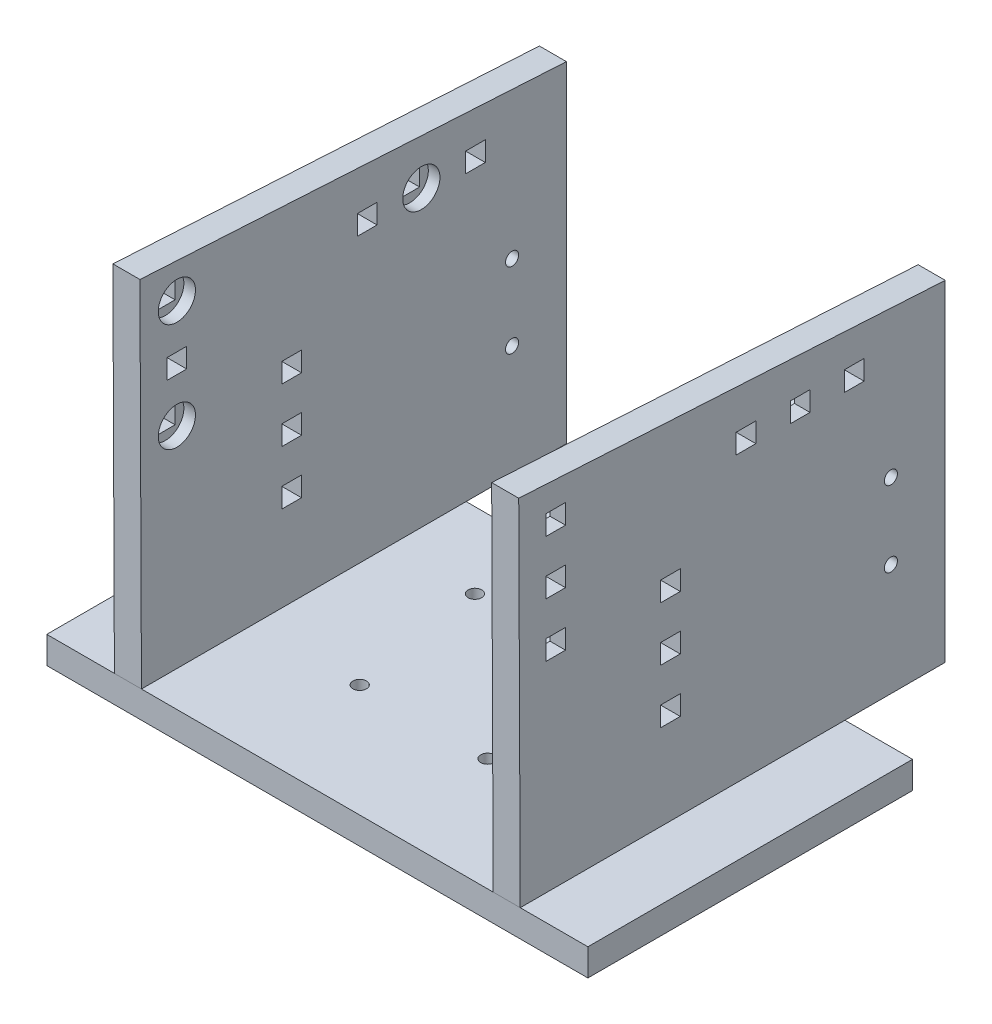
from build123d import *

# Parameters (mm, degrees)
SKETCH1_W                                     = 127
SKETCH1_H                                     = 76.2
BOSS_EXTRUDE1_DEPTH                           = 6.35
SKETCH3_R                                     = 1.5367
SKETCH3_W                                     = 4.6228
SKETCH3_H                                     = 4.6228
BOSS_EXTRUDE2_DEPTH                           = 6.35
CBORE_FOR_8_BUTTON_HEAD_CAP_SCREW1_AT_2_COUNT = 2
CBORE_FOR_8_BUTTON_HEAD_CAP_SCREW1_AT_2_PITCH = 57.667566167
CBORE_FOR_8_BUTTON_HEAD_CAP_SCREW1_AT_3_COUNT = 2
CBORE_FOR_8_BUTTON_HEAD_CAP_SCREW1_AT_3_PITCH = 60.644913617
SKETCH4_R                                     = 1.6
CUT_EXTRUDE1_DEPTH                            = 185.758568144


with BuildPart() as part:
    # Sketch1 → Boss-Extrude1 (new body)
    with BuildSketch(Plane(origin=(0, 0, 0), x_dir=(1, 0, 0), z_dir=(0, 1, 0))):
        with Locations((63.5, 38.1)):
            Rectangle(SKETCH1_W, SKETCH1_H)
    extrude(amount=BOSS_EXTRUDE1_DEPTH)

    # Sketch3 → Boss-Extrude2 (add)
    with BuildSketch(Plane(origin=(104.775, 0, 0), x_dir=(0, 0, -1), z_dir=(1, 0, 0))):
        Polygon((0, 6.35), (-0.3556, 89.7636), (99.7458, 83.9978), (99.7458, 6.35), align=None)
        with Locations((86.986368363, 50.326031637)):
            Circle(SKETCH3_R, mode=Mode.SUBTRACT)
        with Locations((86.986368363, 32.596831637)):
            Circle(SKETCH3_R, mode=Mode.SUBTRACT)
        with Locations((8.3058, 55.7022)):
            Rectangle(SKETCH3_W, SKETCH3_H, mode=Mode.SUBTRACT)
        with Locations((8.3058, 68.4022)):
            Rectangle(SKETCH3_W, SKETCH3_H, mode=Mode.SUBTRACT)
        with Locations((35.246568363, 41.461431637)):
            Rectangle(SKETCH3_W, SKETCH3_H, mode=Mode.SUBTRACT)
        with Locations((78.3844, 75.3364)):
            Rectangle(SKETCH3_W, SKETCH3_H, mode=Mode.SUBTRACT)
        with Locations((8.3058, 81.1022)):
            Rectangle(SKETCH3_W, SKETCH3_H, mode=Mode.SUBTRACT)
        with Locations((35.246568363, 54.161431637)):
            Rectangle(SKETCH3_W, SKETCH3_H, mode=Mode.SUBTRACT)
        with Locations((35.246568363, 28.761431637)):
            Rectangle(SKETCH3_W, SKETCH3_H, mode=Mode.SUBTRACT)
        with Locations((65.6844, 75.3364)):
            Rectangle(SKETCH3_W, SKETCH3_H, mode=Mode.SUBTRACT)
        with Locations((52.9844, 75.3364)):
            Rectangle(SKETCH3_W, SKETCH3_H, mode=Mode.SUBTRACT)
    boss_extrude2 = extrude(amount=BOSS_EXTRUDE2_DEPTH)

    # Sketch6 → CBORE for #8 Button Head Cap Screw1 (revolve, cut)
    with BuildSketch(Plane(origin=(104.775, 75.3364, -65.6844), x_dir=(0, 0, 1), z_dir=(0, 1, 0))):
        Polygon((0, 0), (0, 22.225), (2.2479, 22.225), (2.2479, 2.7178), (4.36626, 2.7178), (4.36626, 0), align=None)
    cbore_for_8_button_head_cap_screw1 = revolve(axis=Axis((98.425, 75.3364, -65.6844), (1, 0, 0)), mode=Mode.SUBTRACT)

    # CBORE for #8 Button Head Cap Screw1 at 2: CBORE for #8 Button Head Cap Screw1 ×2
    with Locations(*[Vector(0, 0.09998341153022382, 0.9949891041708838) * (i * CBORE_FOR_8_BUTTON_HEAD_CAP_SCREW1_AT_2_PITCH) for i in range(1, CBORE_FOR_8_BUTTON_HEAD_CAP_SCREW1_AT_2_COUNT)]):
        add(cbore_for_8_button_head_cap_screw1, mode=Mode.SUBTRACT)

    # CBORE for #8 Button Head Cap Screw1 at 3: CBORE for #8 Button Head Cap Screw1 ×2
    with Locations(*[Vector(0, -0.32375674774697566, 0.9461403533769719) * (i * CBORE_FOR_8_BUTTON_HEAD_CAP_SCREW1_AT_3_PITCH) for i in range(1, CBORE_FOR_8_BUTTON_HEAD_CAP_SCREW1_AT_3_COUNT)]):
        add(cbore_for_8_button_head_cap_screw1, mode=Mode.SUBTRACT)

    # Mirror1: Boss-Extrude2, CBORE for #8 Button Head Cap Screw1 across plane
    add(boss_extrude2.mirror(Plane(origin=(63.5, 0, 0), x_dir=(0, 0, 1), z_dir=(1, 0, 0))))
    add(cbore_for_8_button_head_cap_screw1.mirror(Plane(origin=(63.5, 0, 0), x_dir=(0, 0, 1), z_dir=(1, 0, 0))), mode=Mode.SUBTRACT)

    # Mirror1 copy 1 sketch → Mirror1 copy 1 (revolve, cut)
    with BuildSketch(Plane(origin=(22.225, 81.1022, -8.3058), x_dir=(0, 0, 1), z_dir=(0, 1, 0))):
        Polygon((0, 0), (0, -22.225), (2.2479, -22.225), (2.2479, -2.7178), (4.36626, -2.7178), (4.36626, 0), align=None)
    revolve(axis=Axis((28.575, 81.1022, -8.3058), (1, 0, 0)), mode=Mode.SUBTRACT)

    # Mirror1 copy 2 sketch → Mirror1 copy 2 (revolve, cut)
    with BuildSketch(Plane(origin=(22.225, 55.7022, -8.3058), x_dir=(0, 0, 1), z_dir=(0, 1, 0))):
        Polygon((0, 0), (0, -22.225), (2.2479, -22.225), (2.2479, -2.7178), (4.36626, -2.7178), (4.36626, 0), align=None)
    revolve(axis=Axis((28.575, 55.7022, -8.3058), (1, 0, 0)), mode=Mode.SUBTRACT)

    # Sketch4 → Cut-Extrude1 (cut, through all)
    with BuildSketch(Plane.XZ):
        with Locations(Location((76.999706662, -26.448823052, 0), (0, 0, 270))):
            Circle(SKETCH4_R)
        with Locations(Location((47.000293338, -26.448823052, 0), (0, 0, 270))):
            Circle(SKETCH4_R)
        with Locations(Location((81.99934001, -58.48420412, 0), (0, 0, 270))):
            Circle(SKETCH4_R)
        with Locations(Location((42.00065999, -58.48420412, 0), (0, 0, 270))):
            Circle(SKETCH4_R)
    extrude(amount=-CUT_EXTRUDE1_DEPTH, mode=Mode.SUBTRACT)


solid = part.part
